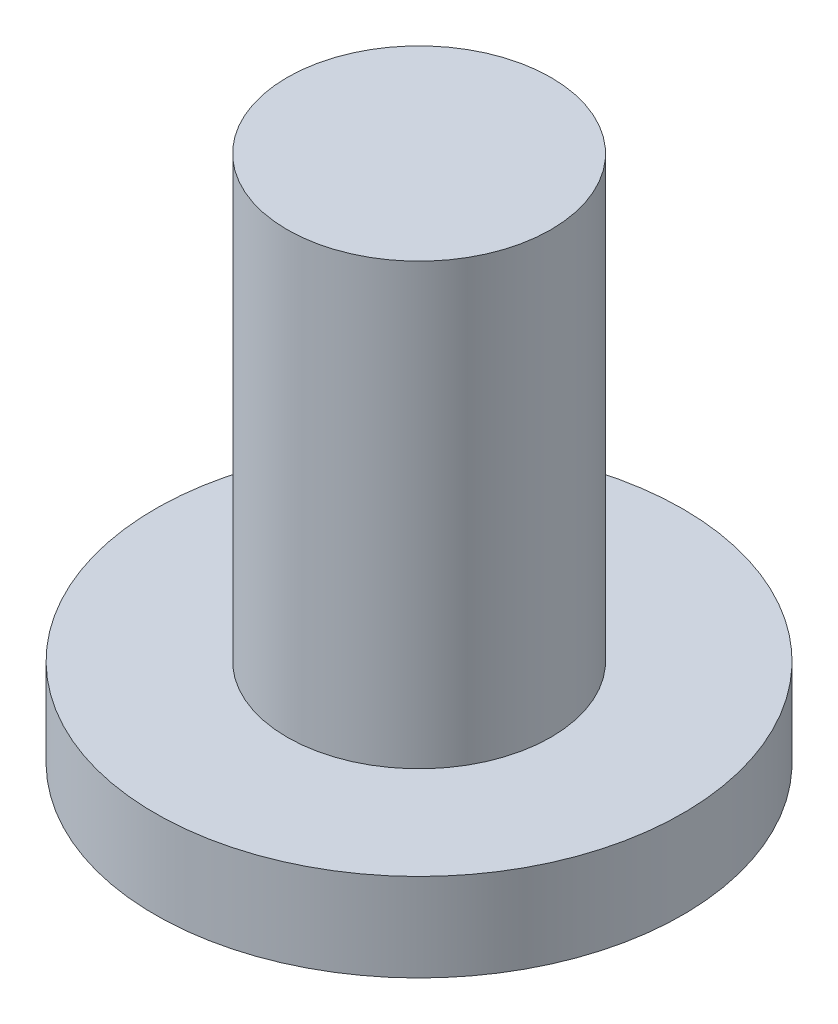
from build123d import *

# Parameters (mm, degrees)
SKETCH1_R           = 3
BOSS_EXTRUDE1_DEPTH = 5
SKETCH2_R           = 6
BOSS_EXTRUDE2_DEPTH = 2


with BuildPart() as part:
    # Sketch1 → Boss-Extrude1 (new, symmetric)
    with BuildSketch(Plane(origin=(0, 0, 0), x_dir=(1, 0, 0), z_dir=(0, 1, 0))):
        with Locations(Location((0, 0, 0), (0, 0, 270))):
            Circle(SKETCH1_R)
    extrude(amount=BOSS_EXTRUDE1_DEPTH, both=True)

    # Sketch2 → Boss-Extrude2 (add)
    with BuildSketch(Plane.XZ.offset(5)):
        with Locations(Location((0, 0, 0), (0, 0, 270))):
            Circle(SKETCH2_R)
    extrude(amount=BOSS_EXTRUDE2_DEPTH)


solid = part.part
